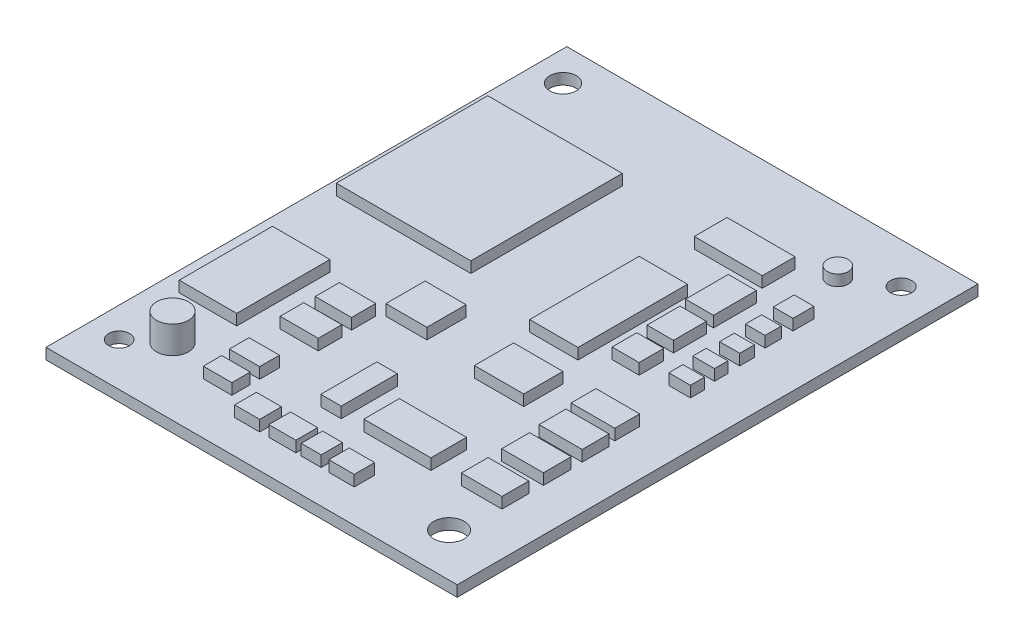
from build123d import *

# Parameters (mm, degrees)
SKETCH1_W           = 30
SKETCH1_H           = 38
BOSS_EXTRUDE1_DEPTH = 0.8
SKETCH2_R           = 1.109088316
SKETCH2_R_2         = 0.767029383
SKETCH2_R_3         = 0.775376329
SKETCH2_R_4         = 0.965264576
CUT_EXTRUDE1_DEPTH  = 0.8
SKETCH3_R           = 0.762390383
SKETCH3_W           = 4.894784697
SKETCH3_H           = 2.593636899
SKETCH3_W_2         = 4.192792091
SKETCH3_H_2         = 6.804733529
SKETCH3_W_3         = 3.597522217
SKETCH3_H_3         = 2.857060704
SKETCH3_W_4         = 3.52833422
SKETCH3_H_4         = 7.990285999
SKETCH3_W_5         = 4.960404455
SKETCH3_H_5         = 2.392024826
SKETCH3_W_6         = 2.649975693
SKETCH3_H_6         = 1.766675078
SKETCH3_W_7         = 2.778355341
SKETCH3_H_7         = 1.719515045
SKETCH3_W_8         = 1.492224114
SKETCH3_H_8         = 4.092690132
SKETCH3_W_9         = 2.214520185
SKETCH3_H_9         = 1.440440718
SKETCH3_W_10        = 2.082297707
SKETCH3_H_10        = 1.343633444
SKETCH3_W_11        = 2.964936673
SKETCH3_H_11        = 1.954523976
SKETCH3_W_12        = 3.040001034
SKETCH3_H_12        = 2.031411973
SKETCH3_W_13        = 3.147081738
SKETCH3_H_13        = 1.964784153
SKETCH3_W_14        = 3.191518467
SKETCH3_H_14        = 1.818199508
SKETCH3_W_15        = 1.580834587
SKETCH3_H_15        = 1.033148902
SKETCH3_W_16        = 1.585712642
SKETCH3_H_16        = 0.978957998
SKETCH3_W_17        = 1.469355228
SKETCH3_H_17        = 1.07248279
SKETCH3_W_18        = 1.436511349
SKETCH3_H_18        = 1.181213981
SKETCH3_W_19        = 1.43651135
SKETCH3_H_19        = 1.521795272
SKETCH3_W_20        = 9.81533928
SKETCH3_H_20        = 11.052195098
BOSS_EXTRUDE2_DEPTH = 0.8
SKETCH4_W           = 1.825068619
SKETCH4_H           = 1.589839684
SKETCH4_W_2         = 1.975600159
SKETCH4_W_3         = 1.455054018
SKETCH4_H_2         = 1.55750712
SKETCH4_W_4         = 1.850712573
SKETCH4_H_3         = 1.49055505
SKETCH4_W_5         = 1.966905423
SKETCH4_H_4         = 1.798635407
SKETCH4_W_6         = 1.927265264
SKETCH4_H_5         = 2.401166398
SKETCH4_W_7         = 2.040835962
SKETCH4_H_6         = 3.123215429
SKETCH4_W_8         = 2.990312219
SKETCH4_H_7         = 2.85468568
BOSS_EXTRUDE3_DEPTH = 0.8
SKETCH5_R           = 1.166233651
BOSS_EXTRUDE4_DEPTH = 2


with BuildPart() as part:
    # Sketch1 → Boss-Extrude1 (new body)
    with BuildSketch(Plane(origin=(0, 0, 0), x_dir=(1, 0, 0), z_dir=(0, 1, 0))):
        Rectangle(SKETCH1_W, SKETCH1_H)
    extrude(amount=BOSS_EXTRUDE1_DEPTH)

    # Sketch2 → Cut-Extrude1 (cut)
    with BuildSketch(Plane(origin=(0, 0.8, 0), x_dir=(1, 0, 0), z_dir=(0, 1, 0))):
        with Locations(Location((11.250748943, -15.842220292, 0), (0, 0, 270))):
            Circle(SKETCH2_R)
        with Locations(Location((-12.822379124, -15.842220292, 0), (0, 0, 270))):
            Circle(SKETCH2_R_2)
        with Locations(Location((12.359837258, 16.028797503, 0), (0, 0, 270))):
            Circle(SKETCH2_R_3)
        with Locations(Location((-12.822379124, 16.54551038, 0), (0, 0, 270))):
            Circle(SKETCH2_R_4)
    extrude(amount=-CUT_EXTRUDE1_DEPTH, mode=Mode.SUBTRACT)

    # Sketch3 → Boss-Extrude2 (add)
    with BuildSketch(Plane(origin=(0, 0.8, 0), x_dir=(1, 0, 0), z_dir=(0, 1, 0))):
        with Locations(Location((9.514606687, 14.257204648, 0), (0, 0, 270))):
            Circle(SKETCH3_R)
        with Locations((4.377365901, -11.445055136)):
            Rectangle(SKETCH3_W, SKETCH3_H)
        with Locations((-11.488143819, -7.293161754)):
            Rectangle(SKETCH3_W_2, SKETCH3_H_2)
        with Locations((4.377365901, -3.89079499)):
            Rectangle(SKETCH3_W_3, SKETCH3_H_3)
        with Locations((3.450098414, 3.595282667)):
            Rectangle(SKETCH3_W_4, SKETCH3_H_4)
        with Locations((4.921355444, 12.052974346)):
            Rectangle(SKETCH3_W_5, SKETCH3_H_5)
        with Locations((-6.265733234, -5.883849823)):
            Rectangle(SKETCH3_W_6, SKETCH3_H_6)
        with Locations((-6.230165426, -8.436309488)):
            Rectangle(SKETCH3_W_7, SKETCH3_H_7)
        with Locations((-0.464784197, -10.695528519)):
            Rectangle(SKETCH3_W_8, SKETCH3_H_8)
        with Locations((-6.296276665, -12.502715855)):
            Rectangle(SKETCH3_W_9, SKETCH3_H_9)
        with Locations((-6.230165426, -14.58062451)):
            Rectangle(SKETCH3_W_10, SKETCH3_H_10)
        with Locations((10.3743464, -11.611945846)):
            Rectangle(SKETCH3_W_11, SKETCH3_H_11)
        with Locations((10.351951393, -8.565924221)):
            Rectangle(SKETCH3_W_12, SKETCH3_H_12)
        with Locations((10.240052284, -5.711675816)):
            Rectangle(SKETCH3_W_13, SKETCH3_H_13)
        with Locations((10.066157491, -3.254157356)):
            Rectangle(SKETCH3_W_14, SKETCH3_H_14)
        with Locations((10.916850927, 1.828837055)):
            Rectangle(SKETCH3_W_15, SKETCH3_H_15)
        with Locations((10.739321253, 3.731847337)):
            Rectangle(SKETCH3_W_16, SKETCH3_H_16)
        with Locations((10.748827302, 5.668032924)):
            Rectangle(SKETCH3_W_17, SKETCH3_H_17)
        with Locations((10.56243198, 7.774708171)):
            Rectangle(SKETCH3_W_18, SKETCH3_H_18)
        with Locations((10.500800241, 10.042163174)):
            Rectangle(SKETCH3_W_19, SKETCH3_H_19)
        with Locations((-9.076372897, 6.688794027)):
            Rectangle(SKETCH3_W_20, SKETCH3_H_20)
    extrude(amount=BOSS_EXTRUDE2_DEPTH)

    # Sketch4 → Boss-Extrude3 (add)
    with BuildSketch(Plane(origin=(0, 0.8, 0), x_dir=(1, 0, 0), z_dir=(0, 1, 0))):
        with Locations((-2.768458169, -15.760115658)):
            Rectangle(SKETCH4_W, SKETCH4_H)
        with Locations((-0.202584614, -15.760115658)):
            Rectangle(SKETCH4_W_2, SKETCH4_H)
        with Locations((1.903702303, -15.77628194)):
            Rectangle(SKETCH4_W_3, SKETCH4_H_2)
        with Locations((4.144992677, -15.837154802)):
            Rectangle(SKETCH4_W_4, SKETCH4_H_3)
        with Locations((7.414099695, 1.774450018)):
            Rectangle(SKETCH4_W_5, SKETCH4_H_4)
        with Locations((7.283749146, 4.735498446)):
            Rectangle(SKETCH4_W_6, SKETCH4_H_5)
        with Locations((7.104971851, 8.134512532)):
            Rectangle(SKETCH4_W_7, SKETCH4_H_6)
        with Locations((-3.066161458, -3.210239912)):
            Rectangle(SKETCH4_W_8, SKETCH4_H_7)
    extrude(amount=BOSS_EXTRUDE3_DEPTH)

    # Sketch5 → Boss-Extrude4 (add)
    with BuildSketch(Plane(origin=(0, 0.8, 0), x_dir=(1, 0, 0), z_dir=(0, 1, 0))):
        with Locations(Location((-10.677990128, -14.091680692, 0), (0, 0, 270))):
            Circle(SKETCH5_R)
    extrude(amount=BOSS_EXTRUDE4_DEPTH)


solid = part.part
